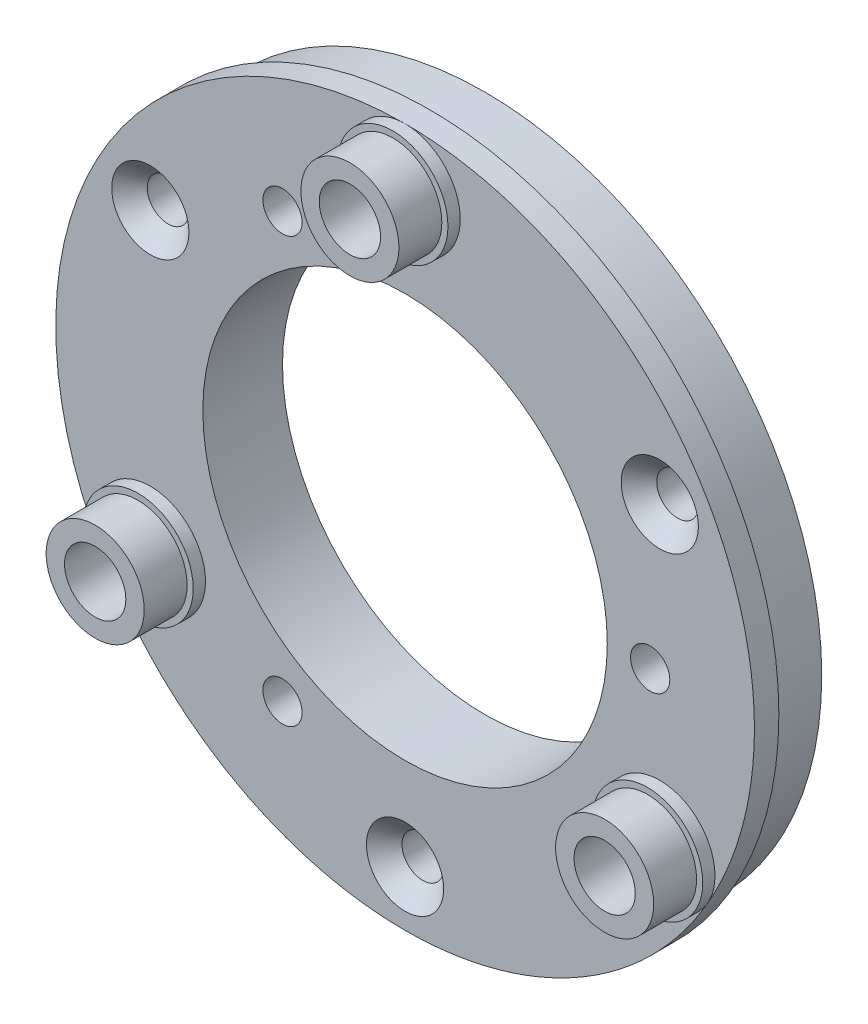
from build123d import *
from build123d.topology import SkipClean

# Parameters (mm, degrees)
SKETCH1_R                                       = 28.5
SKETCH1_R_2                                     = 19.5
BOSS_EXTRUDE1_DEPTH                             = 2
SKETCH2_R                                       = 1.5
CUT_EXTRUDE1_DEPTH                              = 41.354677548
CIRPATTERN1_COUNT                               = 3
BOSS_EXTRUDE2_START                             = 4.5
SKETCH3_R                                       = 27.5
SKETCH3_R_2                                     = 19.5
BOSS_EXTRUDE2_DEPTH                             = 4.5
SKETCH4_R                                       = 4.5
SKETCH4_R_2                                     = 2.5
BOSS_EXTRUDE3_DEPTH                             = 1
SKETCH5_R                                       = 4
SKETCH5_R_2                                     = 2.5
BOSS_EXTRUDE4_DEPTH                             = 3.5
CIRPATTERN6_COUNT                               = 3
SKETCH8_R                                       = 1.5
CUT_EXTRUDE4_DEPTH                              = 41.825849654
CIRPATTERN7_COUNT                               = 3
SKETCH9_R                                       = 1.5
CUT_EXTRUDE5_DEPTH                              = 42.779181419
CIRPATTERN8_COUNT                               = 6
CUT_EXTRUDE6_START                              = -3.5
SKETCH10_R                                      = 2.5
CUT_EXTRUDE6_DEPTH                              = 3.5
CIRPATTERN9_COUNT                               = 3
SKETCH11_R                                      = 19.5
SKETCH11_R_2                                    = 16.5
BOSS_EXTRUDE5_DEPTH                             = 6.5
SKETCH12_R                                      = 1.6
CUT_EXTRUDE7_DEPTH                              = 10
CIRPATTERN10_COUNT                              = 3
CSK_FOR_M3_FLAT_HEAD_MACHINE_SCREW1_D           = 3.4
CSK_FOR_M3_FLAT_HEAD_MACHINE_SCREW1_CSINK_D     = 6.3
CSK_FOR_M3_FLAT_HEAD_MACHINE_SCREW1_CSINK_ANGLE = 90


with BuildPart() as part:
    # Sketch1 → Boss-Extrude1 (new body)
    with BuildSketch(Plane.XY):
        Circle(SKETCH1_R)
        Circle(SKETCH1_R_2, mode=Mode.SUBTRACT)
    extrude(amount=BOSS_EXTRUDE1_DEPTH)

    # Sketch2 → Cut-Extrude1 (cut, through all)
    with BuildSketch(Plane.XY.offset(2)):
        with Locations((0, 24)):
            Circle(SKETCH2_R)
    cut_extrude1 = extrude(amount=-CUT_EXTRUDE1_DEPTH, mode=Mode.SUBTRACT)

    # CirPattern1: Cut-Extrude1 ×3 about axis
    cirpattern1_axis = Axis((0, 0, 0), (0, 0, 1))
    for i in range(1, CIRPATTERN1_COUNT):
        add(cut_extrude1.rotate(cirpattern1_axis, i * 360 / CIRPATTERN1_COUNT), mode=Mode.SUBTRACT)

    # Sketch3 → Boss-Extrude2 (add)
    with SkipClean():  # the faces are left unmerged after this step: merging them gives an invalid solid
        with BuildSketch(Plane(origin=(0, 0, 0), x_dir=(-1, 0, 0), z_dir=(0, 0, -1)).offset(BOSS_EXTRUDE2_START)):
            Circle(SKETCH3_R)
            Circle(SKETCH3_R_2, mode=Mode.SUBTRACT)
        extrude(amount=-BOSS_EXTRUDE2_DEPTH)

    # Sketch4 → Boss-Extrude3 (add)
    with SkipClean():  # the faces are left unmerged after this step: merging them gives an invalid solid
        with BuildSketch(Plane.XY.offset(2)):
            with Locations(Location((0, 24, 0), (0, 0, 269.999655686))):
                Circle(SKETCH4_R)
            with Locations((0, 24)):
                Circle(SKETCH4_R_2, mode=Mode.SUBTRACT)
        boss_extrude3 = extrude(amount=BOSS_EXTRUDE3_DEPTH)

    # Sketch5 → Boss-Extrude4 (add)
    with SkipClean():  # the faces are left unmerged after this step: merging them gives an invalid solid
        with BuildSketch(Plane.XY.offset(3)):
            with Locations((0, 24)):
                Circle(SKETCH5_R)
            with Locations((0, 24)):
                Circle(SKETCH5_R_2, mode=Mode.SUBTRACT)
        boss_extrude4 = extrude(amount=BOSS_EXTRUDE4_DEPTH)

    # CirPattern6: Boss-Extrude3, Boss-Extrude4 ×3 about axis
    with SkipClean():  # the faces are left unmerged after this step: merging them gives an invalid solid
        cirpattern6_axis = Axis((0, 0, 0), (0, 0, 1))
        add([boss_extrude3.rotate(cirpattern6_axis, i * 360 / CIRPATTERN6_COUNT) for i in range(1, CIRPATTERN6_COUNT)])
        add([boss_extrude4.rotate(cirpattern6_axis, i * 360 / CIRPATTERN6_COUNT) for i in range(1, CIRPATTERN6_COUNT)])

    # Sketch8 → Cut-Extrude4 (cut, through all)
    with SkipClean():  # the faces are left unmerged after this step: merging them gives an invalid solid
        with BuildSketch(Plane.XY):
            with Locations((0, 24)):
                Circle(SKETCH8_R)
        cut_extrude4 = extrude(amount=-CUT_EXTRUDE4_DEPTH, mode=Mode.SUBTRACT)

    # CirPattern7: Cut-Extrude4 ×3 about axis
    with SkipClean():  # the faces are left unmerged after this step: merging them gives an invalid solid
        cirpattern7_axis = Axis((0, 0, 0), (0, 0, 1))
        for i in range(1, CIRPATTERN7_COUNT):
            add(cut_extrude4.rotate(cirpattern7_axis, i * 360 / CIRPATTERN7_COUNT), mode=Mode.SUBTRACT)

    # Sketch9 → Cut-Extrude5 (cut, through all)
    with SkipClean():  # the faces are left unmerged after this step: merging them gives an invalid solid
        with BuildSketch(Plane(origin=(0, 0, -4.5), x_dir=(-1, 0, 0), z_dir=(0, 0, -1))):
            with Locations((-20.784609691, 12)):
                Circle(SKETCH9_R)
        cut_extrude5 = extrude(amount=-CUT_EXTRUDE5_DEPTH, mode=Mode.SUBTRACT)

    # CirPattern8: Cut-Extrude5 ×6 about axis, 3 skipped
    with SkipClean():  # the faces are left unmerged after this step: merging them gives an invalid solid
        cirpattern8_axis = Axis((0, 0, -4.5), (0, 0, -1))
        add([cut_extrude5.rotate(cirpattern8_axis, i * 360 / CIRPATTERN8_COUNT) for i in range(1, CIRPATTERN8_COUNT) if i not in (1, 3, 5)], mode=Mode.SUBTRACT)

    # Sketch10 → Cut-Extrude6 (cut)
    with SkipClean():  # the faces are left unmerged after this step: merging them gives an invalid solid
        with BuildSketch(Plane.XY.offset(2).offset(CUT_EXTRUDE6_START)):
            with Locations((0, 24)):
                Circle(SKETCH10_R)
        cut_extrude6 = extrude(amount=CUT_EXTRUDE6_DEPTH, mode=Mode.SUBTRACT)

    # CirPattern9: Cut-Extrude6 ×3 about axis
    with SkipClean():  # the faces are left unmerged after this step: merging them gives an invalid solid
        cirpattern9_axis = Axis((0, 0, 0), (0, 0, -1))
        for i in range(1, CIRPATTERN9_COUNT):
            add(cut_extrude6.rotate(cirpattern9_axis, i * 360 / CIRPATTERN9_COUNT), mode=Mode.SUBTRACT)

    # Sketch11 → Boss-Extrude5 (add)
    with SkipClean():  # the faces are left unmerged after this step: merging them gives an invalid solid
        with BuildSketch(Plane(origin=(0, 0, -4.5), x_dir=(-1, 0, 0), z_dir=(0, 0, -1))):
            Circle(SKETCH11_R)
            Circle(SKETCH11_R_2, mode=Mode.SUBTRACT)
        extrude(amount=-BOSS_EXTRUDE5_DEPTH)

    # Sketch12 → Cut-Extrude7 (cut)
    with SkipClean():  # the faces are left unmerged after this step: merging them gives an invalid solid
        with BuildSketch(Plane(origin=(0, 0, -4.5), x_dir=(-1, 0, 0), z_dir=(0, 0, -1))):
            with Locations((10, 17.320508076)):
                Circle(SKETCH12_R)
        cut_extrude7 = extrude(amount=-CUT_EXTRUDE7_DEPTH, mode=Mode.SUBTRACT)

    # CirPattern10: Cut-Extrude7 ×3 about axis
    with SkipClean():  # the faces are left unmerged after this step: merging them gives an invalid solid
        cirpattern10_axis = Axis((0, 0, 0), (0, 0, 1))
        for i in range(1, CIRPATTERN10_COUNT):
            add(cut_extrude7.rotate(cirpattern10_axis, i * 360 / CIRPATTERN10_COUNT), mode=Mode.SUBTRACT)

    # CSK for M3 Flat Head Machine Screw1 (through all)
    with Locations(Plane(origin=(-20.784609691, 12, 2), x_dir=(1, 0, 0), z_dir=(0, 0, 1))):
        with Locations((0, 0), (41.569219382, 0), (20.784609691, -36)):
            CounterSinkHole(CSK_FOR_M3_FLAT_HEAD_MACHINE_SCREW1_D / 2, CSK_FOR_M3_FLAT_HEAD_MACHINE_SCREW1_CSINK_D / 2, counter_sink_angle=CSK_FOR_M3_FLAT_HEAD_MACHINE_SCREW1_CSINK_ANGLE)


solid = part.part
